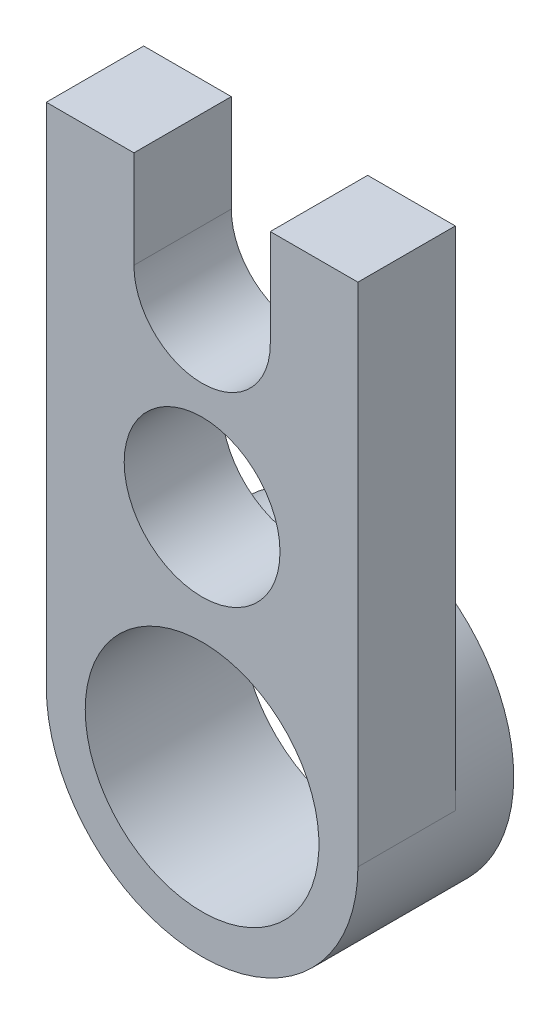
from build123d import *

# Parameters (mm, degrees)
ESQUISSE1_R          = 4
BASE_EXTRUSION_DEPTH = 5
BOSS_EXTRU_1_START   = -8
ESQUISSE2_R          = 8
BOSS_EXTRU_1_DEPTH   = 8
PER_AGE1_D           = 12
PER_AGE1_DEPTH       = 8
PER_AGE1_TIP         = 3.605163714


with BuildPart() as part:
    # Esquisse1 → Base-Extrusion (new body)
    with BuildSketch(Plane.XY):
        with BuildLine():
            Line((-25.742801556, 26), (-30.242801556, 26))
            Line((-30.242801556, 26), (-30.242801556, 0))
            ThreePointArc((-30.242801556, 0), (-22.242801556, -8), (-14.242801556, 0))
            Line((-14.242801556, 0), (-14.242801556, 26))
            Line((-14.242801556, 26), (-18.742801556, 26))
            Line((-18.742801556, 26), (-18.742801556, 21))
            ThreePointArc((-18.742801556, 21), (-22.242801556, 17.5), (-25.742801556, 21))
            Line((-25.742801556, 21), (-25.742801556, 26))
        make_face()
        with Locations(Location((-22.242801556, 12, 0), (0, 0, 270))):
            Circle(ESQUISSE1_R, mode=Mode.SUBTRACT)
    extrude(amount=BASE_EXTRUSION_DEPTH)

    # Esquisse2 → Boss.-Extru.1 (add)
    with BuildSketch(Plane.XY.offset(5).offset(BOSS_EXTRU_1_START)):
        with Locations((-22.242801556, 0)):
            Circle(ESQUISSE2_R)
    extrude(amount=BOSS_EXTRU_1_DEPTH)

    # Perçage1
    with Locations(Plane(origin=(0, 0, -3), x_dir=(-1, 0, 0), z_dir=(0, 0, -1))):
        with Locations((22.242801556, 0)):
            Hole(PER_AGE1_D / 2, depth=PER_AGE1_DEPTH)
            with Locations((0, 0, -(PER_AGE1_DEPTH + PER_AGE1_TIP / 2))):  # 118° drill point
                Cone(0, PER_AGE1_D / 2, PER_AGE1_TIP, mode=Mode.SUBTRACT)


solid = part.part
